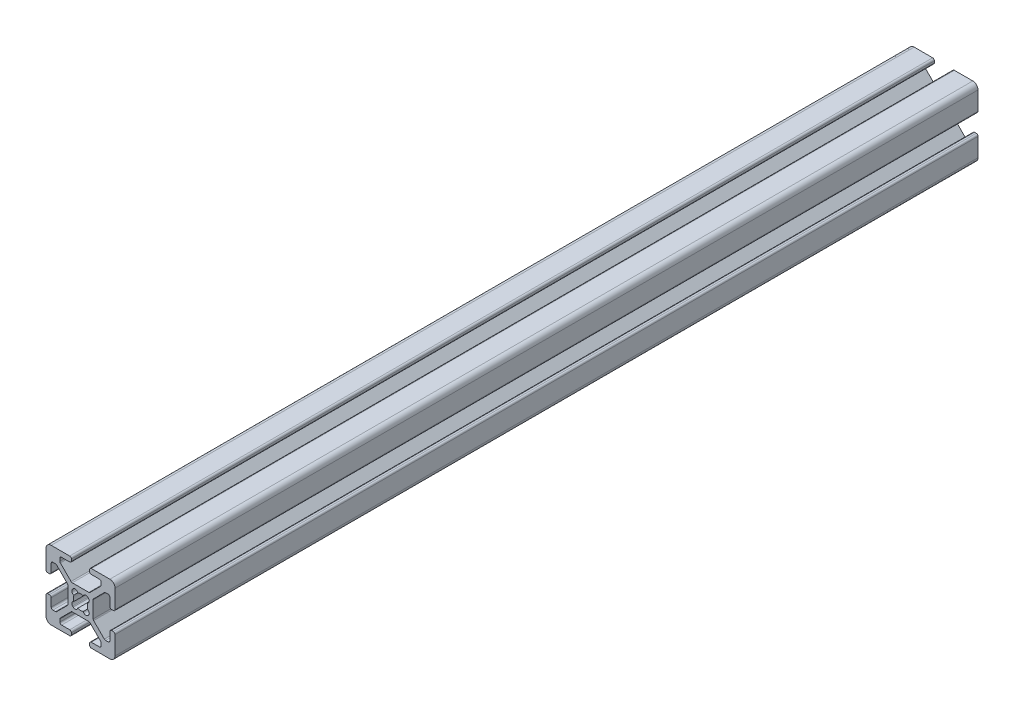
from build123d import *

# Parameters (mm, degrees)
BOSS_EXTRUDE1_DEPTH = 250


with BuildPart() as part:
    # Sketch2 → Boss-Extrude1 (new body)
    with BuildSketch(Plane.XY):
        with BuildLine():
            Line((-10, -3.138), (-10, -8.5))
            ThreePointArc((-10, -8.5), (-9.560660172, -9.560660172), (-8.5, -10))
            Line((-8.5, -10), (-3.138, -10))
            ThreePointArc((-3.138, -10), (-2.778789755, -9.851210245), (-2.63, -9.492))
            Line((-2.63, -9.492), (-2.63, -9.008))
            ThreePointArc((-2.63, -9.008), (-2.778789755, -8.648789755), (-3.138, -8.5))
            Line((-3.138, -8.5), (-5.487, -8.5))
            ThreePointArc((-5.487, -8.5), (-5.846210245, -8.351210245), (-5.995, -7.992))
            Line((-5.995, -7.992), (-5.995, -7.266240833))
            ThreePointArc((-5.995, -7.266240833), (-5.956330803, -7.07183765), (-5.846210245, -6.907030588))
            Line((-5.846210245, -6.907030588), (-2.742969412, -3.803789755))
            ThreePointArc((-2.742969412, -3.803789755), (-2.57816235, -3.693669197), (-2.383759167, -3.655))
            Line((-2.383759167, -3.655), (2.38407951, -3.655))
            ThreePointArc((2.38407951, -3.655), (2.578482694, -3.693669197), (2.743289755, -3.803789755))
            Line((2.743289755, -3.803789755), (5.846210245, -6.906710245))
            ThreePointArc((5.846210245, -6.906710245), (5.956330803, -7.071517306), (5.995, -7.26592049))
            Line((5.995, -7.26592049), (5.995, -7.992))
            ThreePointArc((5.995, -7.992), (5.846210245, -8.351210245), (5.487, -8.5))
            Line((5.487, -8.5), (3.138, -8.5))
            ThreePointArc((3.138, -8.5), (2.778789755, -8.648789755), (2.63, -9.008))
            Line((2.63, -9.008), (2.63, -9.492))
            ThreePointArc((2.63, -9.492), (2.778789755, -9.851210245), (3.138, -10))
            Line((3.138, -10), (8.5, -10))
            ThreePointArc((8.5, -10), (9.560660172, -9.560660172), (10, -8.5))
            Line((10, -8.5), (10, -3.138))
            ThreePointArc((10, -3.138), (9.851210245, -2.778789755), (9.492, -2.63))
            Line((9.492, -2.63), (9.008, -2.63))
            ThreePointArc((9.008, -2.63), (8.648789755, -2.778789755), (8.5, -3.138))
            Line((8.5, -3.138), (8.5, -5.487))
            ThreePointArc((8.5, -5.487), (8.351210245, -5.846210245), (7.992, -5.995))
            Line((7.992, -5.995), (7.266240833, -5.995))
            ThreePointArc((7.266240833, -5.995), (7.07183765, -5.956330803), (6.907030588, -5.846210245))
            Line((6.907030588, -5.846210245), (3.803789755, -2.742969412))
            ThreePointArc((3.803789755, -2.742969412), (3.693669197, -2.57816235), (3.655, -2.383759167))
            Line((3.655, -2.383759167), (3.655, 2.38407951))
            ThreePointArc((3.655, 2.38407951), (3.693669197, 2.578482694), (3.803789755, 2.743289755))
            Line((3.803789755, 2.743289755), (6.906710245, 5.846210245))
            ThreePointArc((6.906710245, 5.846210245), (7.071517306, 5.956330803), (7.26592049, 5.995))
            Line((7.26592049, 5.995), (7.992, 5.995))
            ThreePointArc((7.992, 5.995), (8.351210245, 5.846210245), (8.5, 5.487))
            Line((8.5, 5.487), (8.5, 3.138))
            ThreePointArc((8.5, 3.138), (8.648789755, 2.778789755), (9.008, 2.63))
            Line((9.008, 2.63), (9.492, 2.63))
            ThreePointArc((9.492, 2.63), (9.851210245, 2.778789755), (10, 3.138))
            Line((10, 3.138), (10, 8.5))
            ThreePointArc((10, 8.5), (9.560660172, 9.560660172), (8.5, 10))
            Line((8.5, 10), (3.138, 10))
            ThreePointArc((3.138, 10), (2.778789755, 9.851210245), (2.63, 9.492))
            Line((2.63, 9.492), (2.63, 9.008))
            ThreePointArc((2.63, 9.008), (2.778789755, 8.648789755), (3.138, 8.5))
            Line((3.138, 8.5), (5.487, 8.5))
            ThreePointArc((5.487, 8.5), (5.846210245, 8.351210245), (5.995, 7.992))
            Line((5.995, 7.992), (5.995, 7.266240833))
            ThreePointArc((5.995, 7.266240833), (5.956330803, 7.07183765), (5.846210245, 6.907030588))
            Line((5.846210245, 6.907030588), (2.742969412, 3.803789755))
            ThreePointArc((2.742969412, 3.803789755), (2.57816235, 3.693669197), (2.383759167, 3.655))
            Line((2.383759167, 3.655), (-2.38407951, 3.655))
            ThreePointArc((-2.38407951, 3.655), (-2.578482694, 3.693669197), (-2.743289755, 3.803789755))
            Line((-2.743289755, 3.803789755), (-5.846210245, 6.906710245))
            ThreePointArc((-5.846210245, 6.906710245), (-5.956330803, 7.071517306), (-5.995, 7.26592049))
            Line((-5.995, 7.26592049), (-5.995, 7.992))
            ThreePointArc((-5.995, 7.992), (-5.846210245, 8.351210245), (-5.487, 8.5))
            Line((-5.487, 8.5), (-3.138, 8.5))
            ThreePointArc((-3.138, 8.5), (-2.778789755, 8.648789755), (-2.63, 9.008))
            Line((-2.63, 9.008), (-2.63, 9.492))
            ThreePointArc((-2.63, 9.492), (-2.778789755, 9.851210245), (-3.138, 10))
            Line((-3.138, 10), (-8.5, 10))
            ThreePointArc((-8.5, 10), (-9.560660172, 9.560660172), (-10, 8.5))
            Line((-10, 8.5), (-10, 3.138))
            ThreePointArc((-10, 3.138), (-9.851210245, 2.778789755), (-9.492, 2.63))
            Line((-9.492, 2.63), (-9.008, 2.63))
            ThreePointArc((-9.008, 2.63), (-8.648789755, 2.778789755), (-8.5, 3.138))
            Line((-8.5, 3.138), (-8.5, 5.487))
            ThreePointArc((-8.5, 5.487), (-8.351210245, 5.846210245), (-7.992, 5.995))
            Line((-7.992, 5.995), (-7.266240833, 5.995))
            ThreePointArc((-7.266240833, 5.995), (-7.07183765, 5.956330803), (-6.907030588, 5.846210245))
            Line((-6.907030588, 5.846210245), (-3.803789755, 2.742969412))
            ThreePointArc((-3.803789755, 2.742969412), (-3.693669197, 2.57816235), (-3.655, 2.383759167))
            Line((-3.655, 2.383759167), (-3.655, -2.38407951))
            ThreePointArc((-3.655, -2.38407951), (-3.693669197, -2.578482694), (-3.803789755, -2.743289755))
            Line((-3.803789755, -2.743289755), (-6.906710245, -5.846210245))
            ThreePointArc((-6.906710245, -5.846210245), (-7.071517306, -5.956330803), (-7.26592049, -5.995))
            Line((-7.26592049, -5.995), (-7.992, -5.995))
            ThreePointArc((-7.992, -5.995), (-8.351210245, -5.846210245), (-8.5, -5.487))
            Line((-8.5, -5.487), (-8.5, -3.138))
            ThreePointArc((-8.5, -3.138), (-8.648789755, -2.778789755), (-9.008, -2.63))
            Line((-9.008, -2.63), (-9.492, -2.63))
            ThreePointArc((-9.492, -2.63), (-9.851210245, -2.778789755), (-10, -3.138))
        make_face()
        with BuildLine():
            Line((-2.124493037, 2.304493037), (-2.304493037, 2.124493037))
            ThreePointArc((-2.304493037, 2.124493037), (-2.506016078, 1.35638567), (-1.935777391, 0.803729988))
            ThreePointArc((-1.935777391, 0.803729988), (-2.096, 0), (-1.935777391, -0.803729988))
            ThreePointArc((-1.935777391, -0.803729988), (-2.506016078, -1.35638567), (-2.304493037, -2.124493037))
            Line((-2.304493037, -2.124493037), (-2.124493037, -2.304493037))
            ThreePointArc((-2.124493037, -2.304493037), (-1.35638567, -2.506016078), (-0.803729988, -1.935777391))
            ThreePointArc((-0.803729988, -1.935777391), (0, -2.096), (0.803729988, -1.935777391))
            ThreePointArc((0.803729988, -1.935777391), (1.35638567, -2.506016078), (2.124493037, -2.304493037))
            Line((2.124493037, -2.304493037), (2.304493037, -2.124493037))
            ThreePointArc((2.304493037, -2.124493037), (2.506016078, -1.35638567), (1.935777391, -0.803729988))
            ThreePointArc((1.935777391, -0.803729988), (2.096, 0), (1.935777391, 0.803729988))
            ThreePointArc((1.935777391, 0.803729988), (2.506016078, 1.35638567), (2.304493037, 2.124493037))
            Line((2.304493037, 2.124493037), (2.124493037, 2.304493037))
            ThreePointArc((2.124493037, 2.304493037), (1.35638567, 2.506016078), (0.803729988, 1.935777391))
            ThreePointArc((0.803729988, 1.935777391), (0, 2.096), (-0.803729988, 1.935777391))
            ThreePointArc((-0.803729988, 1.935777391), (-1.35638567, 2.506016078), (-2.124493037, 2.304493037))
        make_face(mode=Mode.SUBTRACT)
    extrude(amount=-BOSS_EXTRUDE1_DEPTH)


solid = part.part
